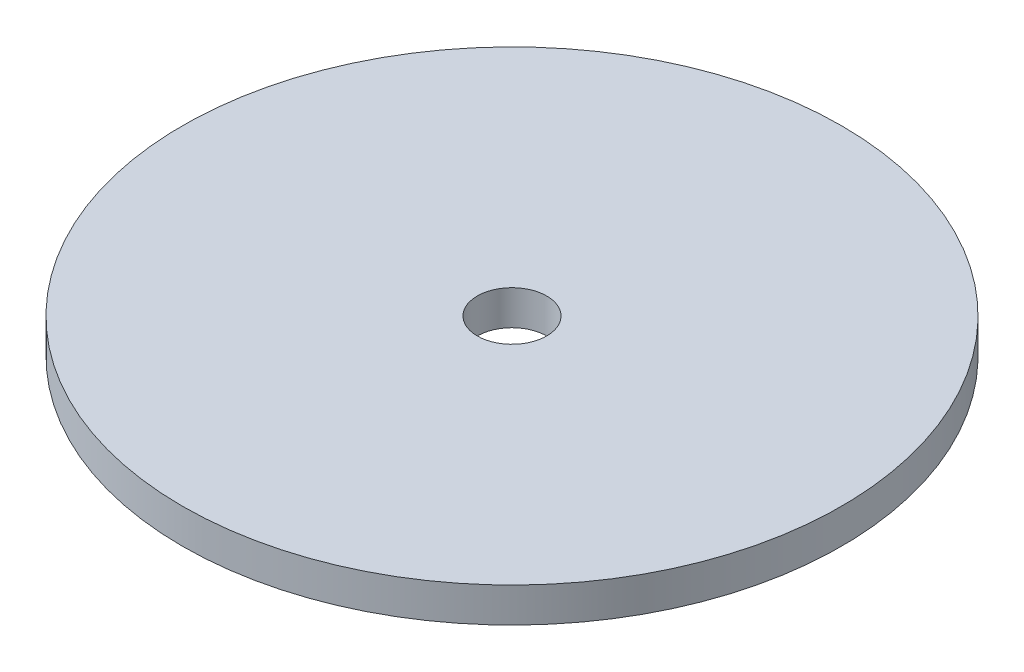
from build123d import *

# Parameters (mm, degrees)
SKETCH1_R           = 47.5
BOSS_EXTRUDE1_DEPTH = 5
SKETCH2_R           = 5
CUT_EXTRUDE1_DEPTH  = 5


with BuildPart() as part:
    # Sketch1 → Boss-Extrude1 (new body)
    with BuildSketch(Plane(origin=(0, 0, 0), x_dir=(1, 0, 0), z_dir=(0, 1, 0))):
        with Locations(Location((0, 0, 0), (0, 0, 270))):
            Circle(SKETCH1_R)
    extrude(amount=BOSS_EXTRUDE1_DEPTH)

    # Sketch2 → Cut-Extrude1 (cut)
    with BuildSketch(Plane(origin=(0, 5, 0), x_dir=(1, 0, 0), z_dir=(0, 1, 0))):
        with Locations(Location((0, 0, 0), (0, 0, 270))):
            Circle(SKETCH2_R)
    extrude(amount=-CUT_EXTRUDE1_DEPTH, mode=Mode.SUBTRACT)


solid = part.part
